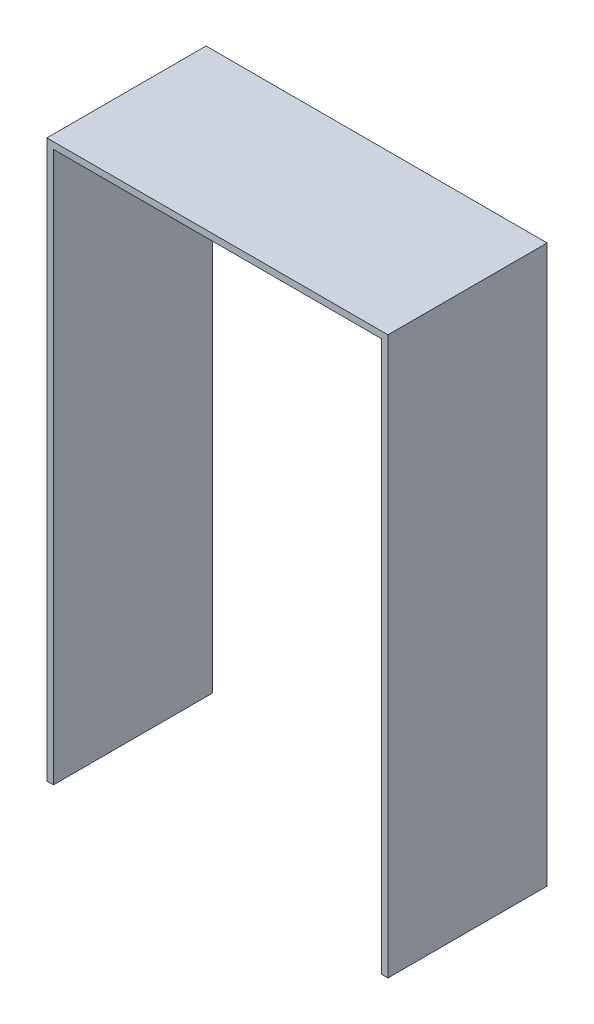
from build123d import *

# Parameters (mm, degrees)
SKETCH1_W           = 163.322
SKETCH1_H           = 266.7
BOSS_EXTRUDE1_DEPTH = 76.2
SKETCH2_W           = 156.972
SKETCH2_H           = 263.525
CUT_EXTRUDE1_DEPTH  = 76.2


with BuildPart() as part:
    # Sketch1 → Boss-Extrude1 (new body)
    with BuildSketch(Plane.XY):
        Rectangle(SKETCH1_W, SKETCH1_H)
    extrude(amount=BOSS_EXTRUDE1_DEPTH)

    # Sketch2 → Cut-Extrude1 (cut)
    with BuildSketch(Plane.XY.offset(76.2)):
        with Locations((0, -1.5875)):
            Rectangle(SKETCH2_W, SKETCH2_H)
    extrude(amount=-CUT_EXTRUDE1_DEPTH, mode=Mode.SUBTRACT)


solid = part.part
